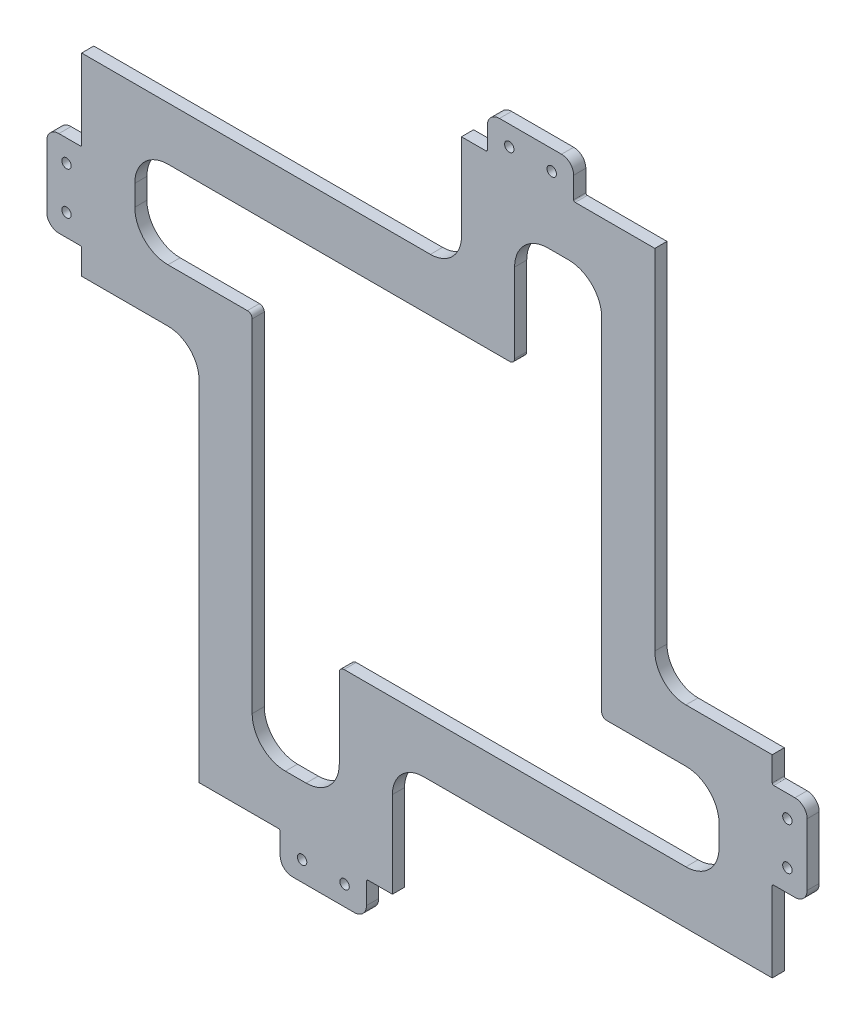
from build123d import *

# Parameters (mm, degrees)
SKETCH2_R          = 0.3937
EXTRUDE1_DEPTH     = 0.508
CIRPATTERN1_COUNT  = 4
CUT_EXTRUDE1_DEPTH = 1.27


with BuildPart() as part:
    # Sketch2 → Extrude1 (new, symmetric)
    with BuildSketch(Plane.XY):
        with BuildLine():
            Line((-11.56208, 14.4526), (6.937248, 14.4526))
            ThreePointArc((6.937248, 14.4526), (7.346029259, 14.621922741), (7.515352, 15.030704))
            Line((7.515352, 15.030704), (7.515352, 21.6789))
            ThreePointArc((7.515352, 21.6789), (8.277304336, 23.518415664), (10.11682, 24.280368))
            Line((10.11682, 24.280368), (11.851132, 24.280368))
            ThreePointArc((11.851132, 24.280368), (13.690647664, 23.518415664), (14.4526, 21.6789))
            Line((14.4526, 21.6789), (14.4526, 5.78104))
            Line((14.4526, 5.78104), (19.077432, 5.78104))
            Line((19.077432, 5.78104), (19.077432, 28.9052))
            Line((19.077432, 28.9052), (12.41171, 28.9052))
            ThreePointArc((12.41171, 28.9052), (12.321907439, 28.942397439), (12.28471, 29.0322))
            Line((12.28471, 29.0322), (12.28471, 30.8102))
            ThreePointArc((12.28471, 30.8102), (11.98713049, 31.52862049), (11.26871, 31.8262))
            Line((11.26871, 31.8262), (6.07441, 31.8262))
            ThreePointArc((6.07441, 31.8262), (5.35598951, 31.52862049), (5.05841, 30.8102))
            Line((5.05841, 30.8102), (5.05841, 29.0322))
            ThreePointArc((5.05841, 29.0322), (5.021212561, 28.942397439), (4.93141, 28.9052))
            Line((4.93141, 28.9052), (2.89052, 28.9052))
            Line((2.89052, 28.9052), (2.89052, 21.6789))
            ThreePointArc((2.89052, 21.6789), (2.128567664, 19.839384336), (0.289052, 19.077432))
            Line((0.289052, 19.077432), (-11.56208, 19.077432))
            Line((-11.56208, 19.077432), (-11.56208, 14.4526))
        make_face()
        with Locations((6.89356, 30.1752)):
            Circle(SKETCH2_R, mode=Mode.SUBTRACT)
        with Locations((10.44956, 30.1752)):
            Circle(SKETCH2_R, mode=Mode.SUBTRACT)
    extrude1 = extrude(amount=EXTRUDE1_DEPTH, both=True)

    # CirPattern1: Extrude1 ×4 about axis
    cirpattern1_axis = Axis((0, 0, -69.733664692), (0, 0, 1))
    for i in range(1, CIRPATTERN1_COUNT):
        add(extrude1.rotate(cirpattern1_axis, i * 360 / CIRPATTERN1_COUNT))

    # Sketch4 → Cut-Extrude1 (cut)
    with BuildSketch(Plane.XY.offset(0.508)):
        with BuildLine():
            Line((-11.851132, -24.458168), (-10.11682, -24.458168))
            ThreePointArc((-10.11682, -24.458168), (-8.15158075, -23.64413925), (-7.337552, -21.6789))
            Line((-7.337552, -21.6789), (-7.337552, -15.030704))
            ThreePointArc((-7.337552, -15.030704), (-7.220305673, -14.747646327), (-6.937248, -14.6304))
            Line((-6.937248, -14.6304), (21.6789, -14.6304))
            ThreePointArc((21.6789, -14.6304), (23.64413925, -13.81637125), (24.458168, -11.851132))
            Line((24.458168, -11.851132), (24.458168, -10.11682))
            ThreePointArc((24.458168, -10.11682), (23.64413925, -8.15158075), (21.6789, -7.337552))
            Line((21.6789, -7.337552), (15.030704, -7.337552))
            ThreePointArc((15.030704, -7.337552), (14.747646327, -7.220305673), (14.6304, -6.937248))
            Line((14.6304, -6.937248), (14.6304, 21.6789))
            ThreePointArc((14.6304, 21.6789), (13.81637125, 23.64413925), (11.851132, 24.458168))
            Line((11.851132, 24.458168), (10.11682, 24.458168))
            ThreePointArc((10.11682, 24.458168), (8.15158075, 23.64413925), (7.337552, 21.6789))
            Line((7.337552, 21.6789), (7.337552, 15.030704))
            ThreePointArc((7.337552, 15.030704), (7.220305673, 14.747646327), (6.937248, 14.6304))
            Line((6.937248, 14.6304), (-21.6789, 14.6304))
            ThreePointArc((-21.6789, 14.6304), (-23.64413925, 13.81637125), (-24.458168, 11.851132))
            Line((-24.458168, 11.851132), (-24.458168, 10.11682))
            ThreePointArc((-24.458168, 10.11682), (-23.64413925, 8.15158075), (-21.6789, 7.337552))
            Line((-21.6789, 7.337552), (-15.030704, 7.337552))
            ThreePointArc((-15.030704, 7.337552), (-14.747646327, 7.220305673), (-14.6304, 6.937248))
            Line((-14.6304, 6.937248), (-14.6304, -21.6789))
            ThreePointArc((-14.6304, -21.6789), (-13.81637125, -23.64413925), (-11.851132, -24.458168))
        make_face()
    extrude(amount=-CUT_EXTRUDE1_DEPTH, mode=Mode.SUBTRACT)


solid = part.part
